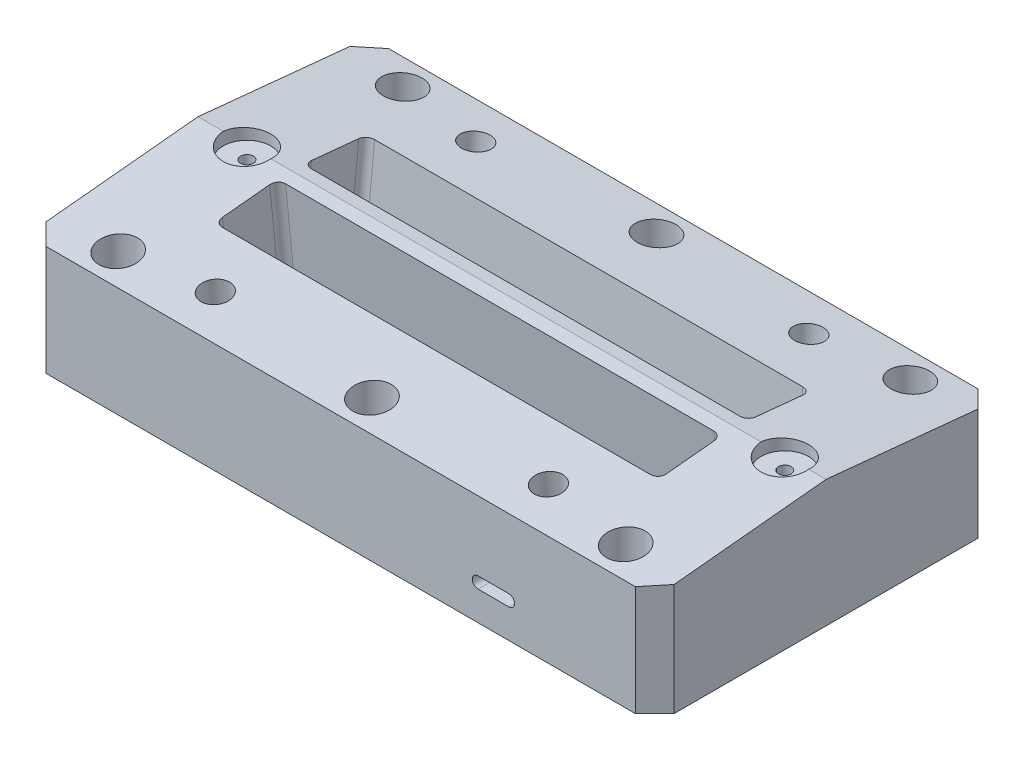
from build123d import *

# Parameters (mm, degrees)
SKETCH1_W            = 198
SKETCH1_H            = 108
BOSS_EXTRUDE1_DEPTH  = 40
SKETCH4_W            = 181
SKETCH4_H            = 45
CUT_EXTRUDE2_DEPTH   = 10
CUT_EXTRUDE3_START   = -198
CUT_EXTRUDE3_DEPTH   = 198
BOSS_EXTRUDE11_DEPTH = 10
CUT_EXTRUDE12_DEPTH  = 198
CUT_EXTRUDE28_DEPTH  = 14.5
CUT_EXTRUDE29_DEPTH  = 14.5
CUT_EXTRUDE40_REACH  = 231.059
SKETCH12_R           = 3.15
CUT_EXTRUDE9_DEPTH   = 230.058944379
SKETCH13_R           = 4.5
CUT_EXTRUDE10_DEPTH  = 16.5
SKETCH14_R           = 4.5
CUT_EXTRUDE11_DEPTH  = 16.5
SKETCH41_R           = 2.9
CUT_EXTRUDE21_DEPTH  = 7
CUT_EXTRUDE22_DEPTH  = 10
CUT_EXTRUDE23_DEPTH  = 10
CUT_EXTRUDE35_DEPTH  = 55.4
CUT_EXTRUDE34_DEPTH  = 55.4
CUT_EXTRUDE36_DEPTH  = 55.4
SKETCH90_R           = 6.1
CUT_EXTRUDE38_DEPTH  = 17
SKETCH96_R           = 2
CUT_EXTRUDE39_DEPTH  = 230.058944379
SKETCH98_R           = 7.5
CUT_EXTRUDE41_DEPTH  = 4


with BuildPart() as part:
    # Sketch1 → Boss-Extrude1 (new body)
    with BuildSketch(Plane(origin=(0, 0, 0), x_dir=(1, 0, 0), z_dir=(0, 1, 0))):
        with Locations((99, 54)):
            Rectangle(SKETCH1_W, SKETCH1_H)
    extrude(amount=BOSS_EXTRUDE1_DEPTH)

    # Sketch4 → Cut-Extrude2 (cut)
    with BuildSketch(Plane(origin=(0, 0, 0), x_dir=(1, 0, 0), z_dir=(0, 1, 0))):
        with Locations((99, 54)):
            Rectangle(SKETCH4_W, SKETCH4_H)
    extrude(amount=CUT_EXTRUDE2_DEPTH, mode=Mode.SUBTRACT)

    # Sketch5 → Cut-Extrude3 (cut)
    with BuildSketch(Plane(origin=(198, 0, 0), x_dir=(0, 0, -1), z_dir=(1, 0, 0)).offset(CUT_EXTRUDE3_START)):
        Polygon((54, 40), (108, 34.657672686), (108, 40), align=None)
    extrude(amount=CUT_EXTRUDE3_DEPTH, mode=Mode.SUBTRACT)

    # Sketch53 → Boss-Extrude11 (add)
    with BuildSketch(Plane(origin=(0, 10, 0), x_dir=(-1, 0, 0), z_dir=(0, -1, 0))):
        Polygon((-8.5, 51.5), (-8.5, 31.5), (-39.5, 31.5), align=None)
        Polygon((-8.5, 56.5), (-8.5, 76.5), (-39.5, 76.5), align=None)
        Polygon((-158.5, 76.5), (-189.5, 56.5), (-189.5, 76.5), align=None)
        Polygon((-158.5, 31.5), (-189.5, 51.5), (-189.5, 31.5), align=None)
    extrude(amount=BOSS_EXTRUDE11_DEPTH)

    # Sketch18 → Cut-Extrude12 (cut)
    with BuildSketch(Plane(origin=(198, 0, 0), x_dir=(0, 0, -1), z_dir=(1, 0, 0))):
        Polygon((0, 34.657672686), (0, 40), (54, 40), align=None)
    extrude(amount=-CUT_EXTRUDE12_DEPTH, mode=Mode.SUBTRACT)

    # Izq → Cut-Extrude28 (cut)
    with BuildSketch(Plane(origin=(0, 28.012686094, -12.204810084), x_dir=(1, 0, 0), z_dir=(0, 0.9167660546215652, -0.39942458749256926))):
        Polygon((8.5, 48.862182113), (29.5, 70.132603179), (8.5, 70.132603179), align=None)
    cut_extrude28 = extrude(amount=-CUT_EXTRUDE28_DEPTH, mode=Mode.SUBTRACT)

    # Der → Cut-Extrude29 (cut)
    with BuildSketch(Plane(origin=(0, -11.144923858, -4.62106599), x_dir=(1, 0, 0), z_dir=(0, 0.9237421135716327, 0.38301502270043264))):
        Polygon((8.5, 51.290217599), (29.5, 29.097876578), (8.5, 29.097876578), align=None)
    cut_extrude29 = extrude(amount=-CUT_EXTRUDE29_DEPTH, mode=Mode.SUBTRACT)

    # Cut-Extrude40: up to this face of the body (flat: up to its plane)
    cut_extrude40_end = Plane(part.part.faces().sort_by_distance((99, 10, -54))[0])
    # Sketch97 → Cut-Extrude40 (cut, up to the picked face)
    with BuildSketch(Plane(origin=(0, 0, 0), x_dir=(1, 0, 0), z_dir=(0, 1, 0)), mode=Mode.PRIVATE) as cut_extrude40_sk1:
        Polygon((8.5, 57.5), (29.5, 76.5), (158.5, 76.5), (189.5, 56.5), (189.5, 51.5), (158.5, 31.5), (29.5, 31.5), (8.5, 51.5), align=None)
    cut_extrude40_tool1 = split(extrude(cut_extrude40_sk1.sketch, amount=CUT_EXTRUDE40_REACH, mode=Mode.PRIVATE), bisect_by=cut_extrude40_end, keep=Keep.BOTH, mode=Mode.PRIVATE)
    cut_extrude40 = cut_extrude40_tool1.solids().sort_by(Axis((96.82024, 0, -54.014019), (0, 1, 0)))[0]
    add(cut_extrude40, mode=Mode.SUBTRACT)

    # Mirror2: Cut-Extrude28, Cut-Extrude29, Cut-Extrude40 across plane
    add(cut_extrude28.mirror(Plane(origin=(99, 0, 0), x_dir=(0, 0, 1), z_dir=(1, 0, 0))), mode=Mode.SUBTRACT)
    add(cut_extrude29.mirror(Plane(origin=(99, 0, 0), x_dir=(0, 0, 1), z_dir=(1, 0, 0))), mode=Mode.SUBTRACT)
    add(cut_extrude40.mirror(Plane(origin=(99, 0, 0), x_dir=(0, 0, 1), z_dir=(1, 0, 0))), mode=Mode.SUBTRACT)

    # Sketch12 → Cut-Extrude9 (cut, through all)
    with BuildSketch(Plane(origin=(0, 40, 0), x_dir=(1, 0, 0), z_dir=(0, 1, 0))):
        with Locations(Location((19.7, 98.85, 0), (0, 0, 270))):
            Circle(SKETCH12_R)
        with Locations(Location((99.7, 9.15, 0), (0, 0, 270))):
            Circle(SKETCH12_R)
        with Locations(Location((179.7, 9.15, 0), (0, 0, 270))):
            Circle(SKETCH12_R)
        with Locations(Location((19.7, 9.15, 0), (0, 0, 270))):
            Circle(SKETCH12_R)
        with Locations(Location((99.7, 98.85, 0), (0, 0, 270))):
            Circle(SKETCH12_R)
        with Locations(Location((179.7, 98.85, 0), (0, 0, 270))):
            Circle(SKETCH12_R)
    extrude(amount=-CUT_EXTRUDE9_DEPTH, mode=Mode.SUBTRACT)

    # Sketch13 → Cut-Extrude10 (cut)
    with BuildSketch(Plane(origin=(0, 44.902839065, -4.442327104), x_dir=(1, 0, 0), z_dir=(0, 0.9951418638934392, -0.0984513622388844))):
        with Locations(Location((46.5, 91.063226213, 0), (0, 0, 270))):
            Circle(SKETCH13_R)
        with Locations(Location((151.5, 91.063226213, 0), (0, 0, 270))):
            Circle(SKETCH13_R)
    extrude(amount=-CUT_EXTRUDE10_DEPTH, mode=Mode.SUBTRACT)

    # Sketch14 → Cut-Extrude11 (cut)
    with BuildSketch(Plane(origin=(0, 34.032645471, 6.317746484), x_dir=(1, 0, 0), z_dir=(0, 0.995141863893439, 0.09845136223888487))):
        with Locations(Location((46.5, 19.393715592, 0), (0, 0, 270))):
            Circle(SKETCH14_R)
        with Locations(Location((151.5, 19.393715592, 0), (0, 0, 270))):
            Circle(SKETCH14_R)
    extrude(amount=-CUT_EXTRUDE11_DEPTH, mode=Mode.SUBTRACT)

    # Sketch41 → Cut-Extrude21 (cut)
    with BuildSketch(Plane(origin=(0, 0, 0), x_dir=(1, 0, 0), z_dir=(0, 1, 0))):
        with Locations(Location((139.5, 9, 0), (0, 0, 90))):
            Circle(SKETCH41_R)
        with Locations(Location((139.5, 99, 0), (0, 0, 90))):
            Circle(SKETCH41_R)
    extrude(amount=CUT_EXTRUDE21_DEPTH, mode=Mode.SUBTRACT)

    # Sketch42 → Cut-Extrude22 (cut)
    with BuildSketch(Plane.XY):
        with BuildLine():
            Line((142.3, 12.8), (152, 12.8))
            ThreePointArc((152, 12.8), (153.8, 11), (152, 9.2))
            Line((152, 9.2), (142.3, 9.2))
            ThreePointArc((142.3, 9.2), (140.5, 11), (142.3, 12.8))
        make_face()
    extrude(amount=-CUT_EXTRUDE22_DEPTH, mode=Mode.SUBTRACT)

    # Sketch43 → Cut-Extrude23 (cut)
    with BuildSketch(Plane(origin=(0, 0, -108), x_dir=(-1, 0, 0), z_dir=(0, 0, -1))):
        with BuildLine():
            Line((-55.7, 12.8), (-46, 12.8))
            ThreePointArc((-46, 12.8), (-44.2, 11), (-46, 9.2))
            Line((-46, 9.2), (-55.7, 9.2))
            ThreePointArc((-55.7, 9.2), (-57.5, 11), (-55.7, 12.8))
        make_face()
    extrude(amount=-CUT_EXTRUDE23_DEPTH, mode=Mode.SUBTRACT)

    # Sketch84 → Cut-Extrude35 (cut)
    with BuildSketch(Plane(origin=(0, 44.902839065, -4.442327104), x_dir=(1, 0, 0), z_dir=(0, 0.9951418638934392, -0.0984513622388844))):
        with BuildLine():
            Line((31.7, 53.899606161), (166.7, 53.899606161))
            ThreePointArc((166.7, 53.899606161), (168.467766953, 54.631839208), (169.2, 56.399606161))
            Line((169.2, 56.399606161), (169.2, 71.399606161))
            ThreePointArc((169.2, 71.399606161), (168.467766953, 73.167373114), (166.7, 73.899606161))
            Line((166.7, 73.899606161), (31.7, 73.899606161))
            ThreePointArc((31.7, 73.899606161), (29.932233047, 73.167373114), (29.2, 71.399606161))
            Line((29.2, 71.399606161), (29.2, 56.399606161))
            ThreePointArc((29.2, 56.399606161), (29.932233047, 54.631839208), (31.7, 53.899606161))
        make_face()
    extrude(amount=-CUT_EXTRUDE35_DEPTH, mode=Mode.SUBTRACT)

    # Sketch83 → Cut-Extrude34 (cut)
    with BuildSketch(Plane(origin=(0, 34.321747276, 3.395518666), x_dir=(1, 0, 0), z_dir=(0, 0.9951418638934391, 0.0984513622388849))):
        with BuildLine():
            Line((31.7, 53.57571514), (166.7, 53.57571514))
            ThreePointArc((166.7, 53.57571514), (168.467766953, 52.843482093), (169.2, 51.07571514))
            Line((169.2, 51.07571514), (169.2, 36.07571514))
            ThreePointArc((169.2, 36.07571514), (168.467766953, 34.307948187), (166.7, 33.57571514))
            Line((166.7, 33.57571514), (31.7, 33.57571514))
            ThreePointArc((31.7, 33.57571514), (29.932233047, 34.307948187), (29.2, 36.07571514))
            Line((29.2, 36.07571514), (29.2, 51.07571514))
            ThreePointArc((29.2, 51.07571514), (29.932233047, 52.843482093), (31.7, 53.57571514))
        make_face()
    extrude(amount=-CUT_EXTRUDE34_DEPTH, mode=Mode.SUBTRACT)

    # Sketch85 → Cut-Extrude36 (cut)
    with BuildSketch(Plane(origin=(0, 40, 0), x_dir=(1, 0, 0), z_dir=(0, 1, 0))):
        Polygon((0, 101.9), (6.1, 108), (0, 108), align=None)
        Polygon((0, 0), (6.1, 0), (0, 6.1), align=None)
        Polygon((198, 6.1), (191.9, 0), (198, 0), align=None)
        Polygon((198, 108), (191.9, 108), (198, 101.9), align=None)
    extrude(amount=-CUT_EXTRUDE36_DEPTH, mode=Mode.SUBTRACT)

    # Sketch90 → Cut-Extrude38 (cut)
    with BuildSketch(Plane(origin=(0, 40, 0), x_dir=(1, 0, 0), z_dir=(0, 1, 0))):
        with Locations(Location((19.7, 9.15, 0), (0, 0, 270))):
            Circle(SKETCH90_R)
        with Locations(Location((99.7, 9.15, 0), (0, 0, 270))):
            Circle(SKETCH90_R)
        with Locations(Location((179.7, 9.15, 0), (0, 0, 270))):
            Circle(SKETCH90_R)
        with Locations(Location((99.7, 98.85, 0), (0, 0, 270))):
            Circle(SKETCH90_R)
        with Locations(Location((179.7, 98.85, 0), (0, 0, 270))):
            Circle(SKETCH90_R)
        with Locations(Location((19.7, 98.85, 0), (0, 0, 270))):
            Circle(SKETCH90_R)
    extrude(amount=-CUT_EXTRUDE38_DEPTH, mode=Mode.SUBTRACT)

    # Sketch96 → Cut-Extrude39 (cut, through all)
    with BuildSketch(Plane(origin=(0, 0, 0), x_dir=(1, 0, 0), z_dir=(0, 1, 0))):
        with Locations(Location((15.45, 54, 0), (0, 0, 180))):
            Circle(SKETCH96_R)
        with Locations((185, 54)):
            Circle(SKETCH96_R)
    extrude(amount=CUT_EXTRUDE39_DEPTH, mode=Mode.SUBTRACT)

    # Sketch98 → Cut-Extrude41 (cut)
    with BuildSketch(Plane(origin=(0, 40, 0), x_dir=(1, 0, 0), z_dir=(0, 1, 0))):
        with Locations(Location((185, 54, 0), (0, 0, 270))):
            Circle(SKETCH98_R)
        with Locations(Location((15.45, 54, 0), (0, 0, 270))):
            Circle(SKETCH98_R)
    extrude(amount=-CUT_EXTRUDE41_DEPTH, mode=Mode.SUBTRACT)


solid = part.part
